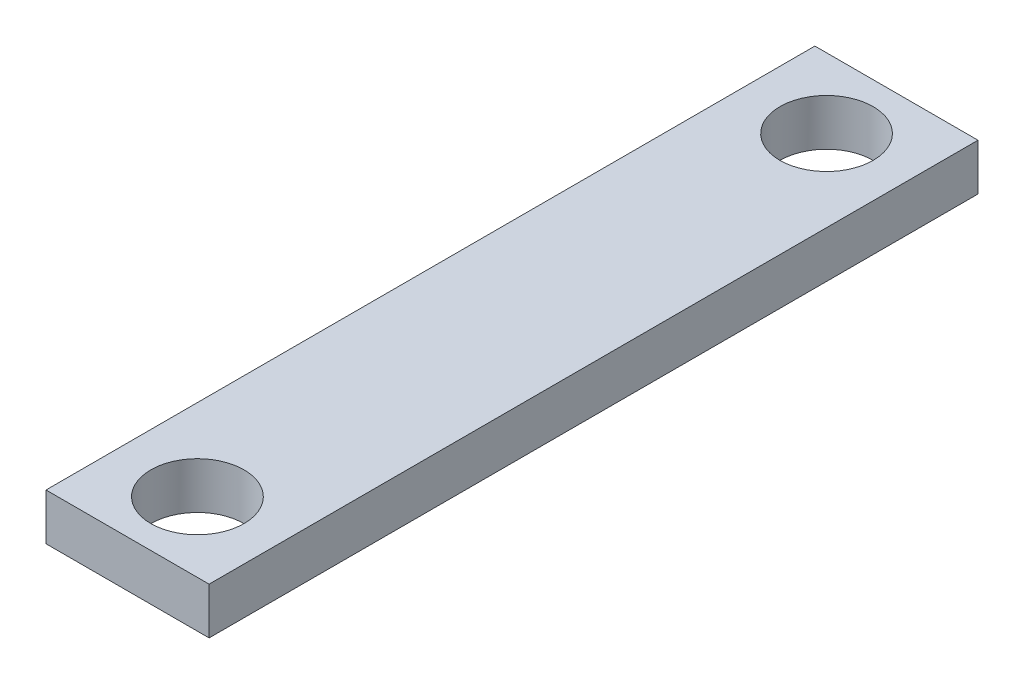
from build123d import *

# Parameters (mm, degrees)
SKETCH1_W           = 7
SKETCH1_H           = 2
BOSS_EXTRUDE1_DEPTH = 33
CUT_EXTRUDE1_REACH  = 35.793
SKETCH2_R           = 2


with BuildPart() as part:
    # Sketch1 → Boss-Extrude1 (new body)
    with BuildSketch(Plane.XY):
        with Locations((3.5, 1)):
            Rectangle(SKETCH1_W, SKETCH1_H)
    extrude(amount=BOSS_EXTRUDE1_DEPTH)

    # Sketch2 → Cut-Extrude1 (cut, up to next)
    with BuildSketch(Plane(origin=(0, 2, 0), x_dir=(1, 0, 0), z_dir=(0, 1, 0)), mode=Mode.PRIVATE) as cut_extrude1_sk1:
        with Locations(Location((3.5, -30, 0), (0, 0, 270))):
            Circle(SKETCH2_R)
    cut_extrude1_tool1 = extrude(cut_extrude1_sk1.sketch, amount=-CUT_EXTRUDE1_REACH, mode=Mode.PRIVATE) & part.part
    # Sketch2 → Cut-Extrude1 (cut, up to next)
    with BuildSketch(Plane(origin=(0, 2, 0), x_dir=(1, 0, 0), z_dir=(0, 1, 0)), mode=Mode.PRIVATE) as cut_extrude1_sk2:
        with Locations(Location((3.5, -3, 0), (0, 0, 270))):
            Circle(SKETCH2_R)
    cut_extrude1_tool2 = extrude(cut_extrude1_sk2.sketch, amount=-CUT_EXTRUDE1_REACH, mode=Mode.PRIVATE) & part.part
    add(cut_extrude1_tool1.solids().sort_by_distance((3.5, 2, 30))[0], mode=Mode.SUBTRACT)
    add(cut_extrude1_tool2.solids().sort_by_distance((3.5, 2, 3))[0], mode=Mode.SUBTRACT)


solid = part.part
